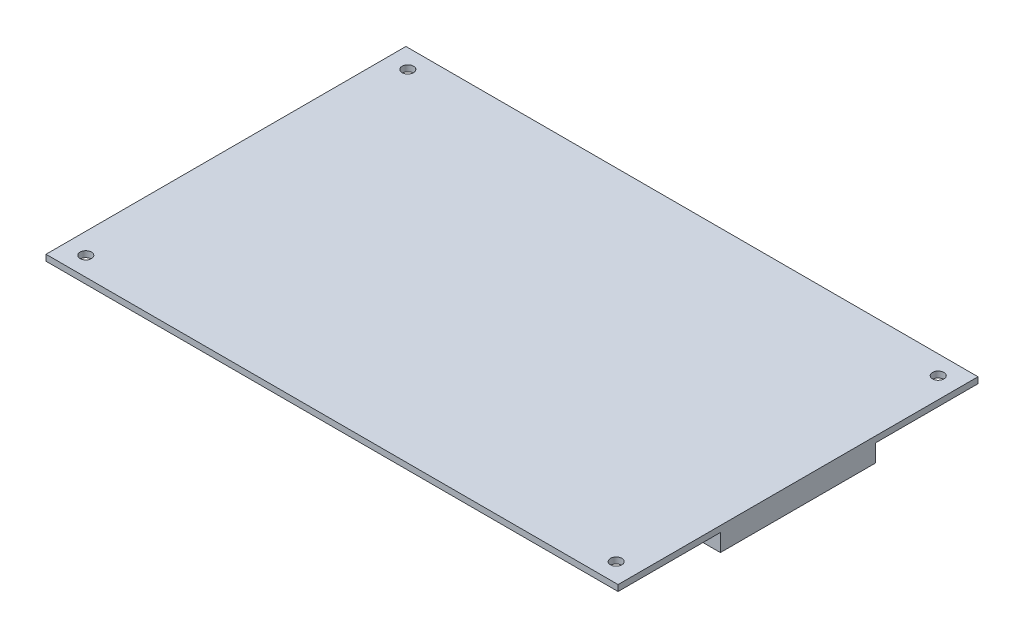
from build123d import *

# Parameters (mm, degrees)
SKETCH_1_W          = 151
SKETCH_1_H          = 95
EXTRUDE_1_DEPTH     = 1.6
SKETCH_2_W          = 41
SKETCH_2_H          = 4.6
EXTRUDE_2_DEPTH     = 151
SKETCH_3_R          = 1.5
CUT_EXTRUDE_1_DEPTH = 179.506134348


with BuildPart() as part:
    # 草图1 → 凸台-拉伸1 (new body)
    with BuildSketch(Plane(origin=(0, 0, 0), x_dir=(1, 0, 0), z_dir=(0, 1, 0))):
        with Locations((75.5, -47.5)):
            Rectangle(SKETCH_1_W, SKETCH_1_H)
    extrude(amount=EXTRUDE_1_DEPTH)

    # 草图2 → 凸台-拉伸2 (add)
    with BuildSketch(Plane.ZY):
        with Locations((47.5, -2.3)):
            Rectangle(SKETCH_2_W, SKETCH_2_H)
    extrude(amount=-EXTRUDE_2_DEPTH)

    # 草图3 → 切除-拉伸1 (cut, through all)
    with BuildSketch(Plane(origin=(0, 1.6, 0), x_dir=(1, 0, 0), z_dir=(0, 1, 0))):
        with Locations(Location((5.5, -5, 0), (0, 0, 270))):
            Circle(SKETCH_3_R)
        with Locations(Location((5.5, -90, 0), (0, 0, 270))):
            Circle(SKETCH_3_R)
        with Locations(Location((145.5, -90, 0), (0, 0, 270))):
            Circle(SKETCH_3_R)
        with Locations(Location((145.5, -5, 0), (0, 0, 270))):
            Circle(SKETCH_3_R)
    extrude(amount=-CUT_EXTRUDE_1_DEPTH, mode=Mode.SUBTRACT)


solid = part.part
